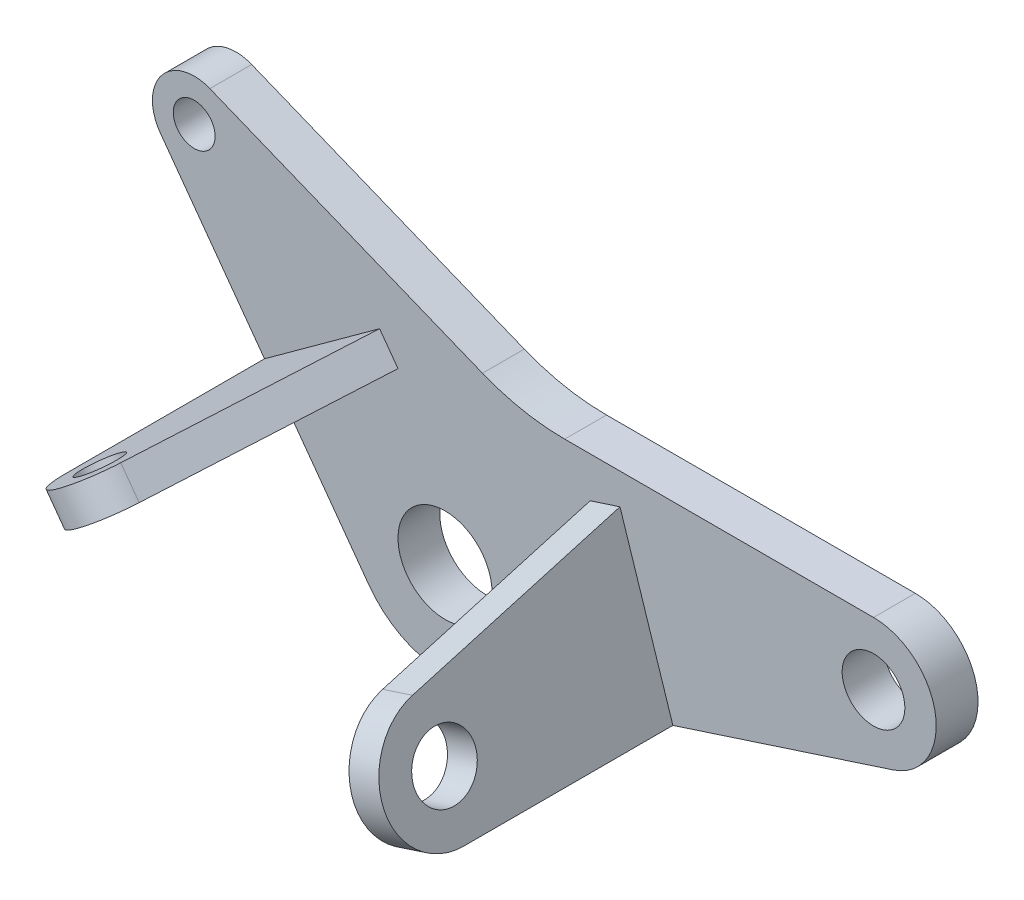
from build123d import *

# Parameters (mm, degrees)
SKETCH1_R           = 9
SKETCH1_R_2         = 6
SKETCH1_R_3         = 4
BOSS_EXTRUDE1_DEPTH = 8
SKETCH4_R           = 4
BOSS_EXTRUDE3_DEPTH = 6
SKETCH3_R           = 6
BOSS_EXTRUDE4_DEPTH = 6


with BuildPart() as part:
    # Sketch1 → Boss-Extrude1 (new body)
    with BuildSketch(Plane.XY):
        with BuildLine():
            Line((22.899881176, 32.334641746), (82, 32.334641746))
            ThreePointArc((82, 32.334641746), (93.852260087, 22.211855326), (85.708203932, 8.92196355))
            Line((85.708203932, 8.92196355), (5.562305899, -17.119017293))
            ThreePointArc((5.562305899, -17.119017293), (-5.562305899, -17.119017293), (-14.562305899, -10.580134541))
            Line((-14.562305899, -10.580134541), (-54.472135955, 44.351033997))
            ThreePointArc((-54.472135955, 44.351033997), (-54.304086029, 53.978607818), (-45.003147253, 56.470786852))
            Line((-45.003147253, 56.470786852), (7.166404253, 35.392919854))
            ThreePointArc((7.166404253, 35.392919854), (14.88590337, 33.106300041), (22.899881176, 32.334641746))
        make_face()
        Circle(SKETCH1_R, mode=Mode.SUBTRACT)
        with Locations((82, 20.334641746)):
            Circle(SKETCH1_R_2, mode=Mode.SUBTRACT)
        with Locations((-48, 49.053316016)):
            Circle(SKETCH1_R_3, mode=Mode.SUBTRACT)
    extrude(amount=BOSS_EXTRUDE1_DEPTH)

    # Sketch4 → Boss-Extrude3 (add)
    with BuildSketch(Plane(origin=(-19.984698578, 27.506577809, 0), x_dir=(0.8090169943749441, 0.5877852522924778, 0), z_dir=(0.5877852522924778, -0.8090169943749442, 0))):
        with BuildLine():
            Line((-2.309906432, 48.205098847), (9.218720146, 8))
            Line((9.218720146, 8), (-18, 8))
            Line((-18, 8), (-18, 46))
            ThreePointArc((-18, 46), (-11.113384808, 53.92214455), (-2.309906432, 48.205098847))
        make_face()
        with Locations((-10, 46)):
            Circle(SKETCH4_R, mode=Mode.SUBTRACT)
    extrude(amount=BOSS_EXTRUDE3_DEPTH)

    # Sketch3 → Boss-Extrude4 (add)
    with BuildSketch(Plane(origin=(32.335921554, 10.506577809, 0), x_dir=(-0.30901699437494856, 0.9510565162951532, 0), z_dir=(0.9510565162951532, 0.30901699437494856, 0))):
        with BuildLine():
            Line((-18, 8), (-18, 48))
            ThreePointArc((-18, 48), (-7.254341559, 59.934262744), (5.737771209, 50.49494029))
            Line((5.737771209, 50.49494029), (14.770349605, 8))
            Line((14.770349605, 8), (-18, 8))
        make_face()
        with Locations((-6, 48)):
            Circle(SKETCH3_R, mode=Mode.SUBTRACT)
    extrude(amount=BOSS_EXTRUDE4_DEPTH)


solid = part.part
